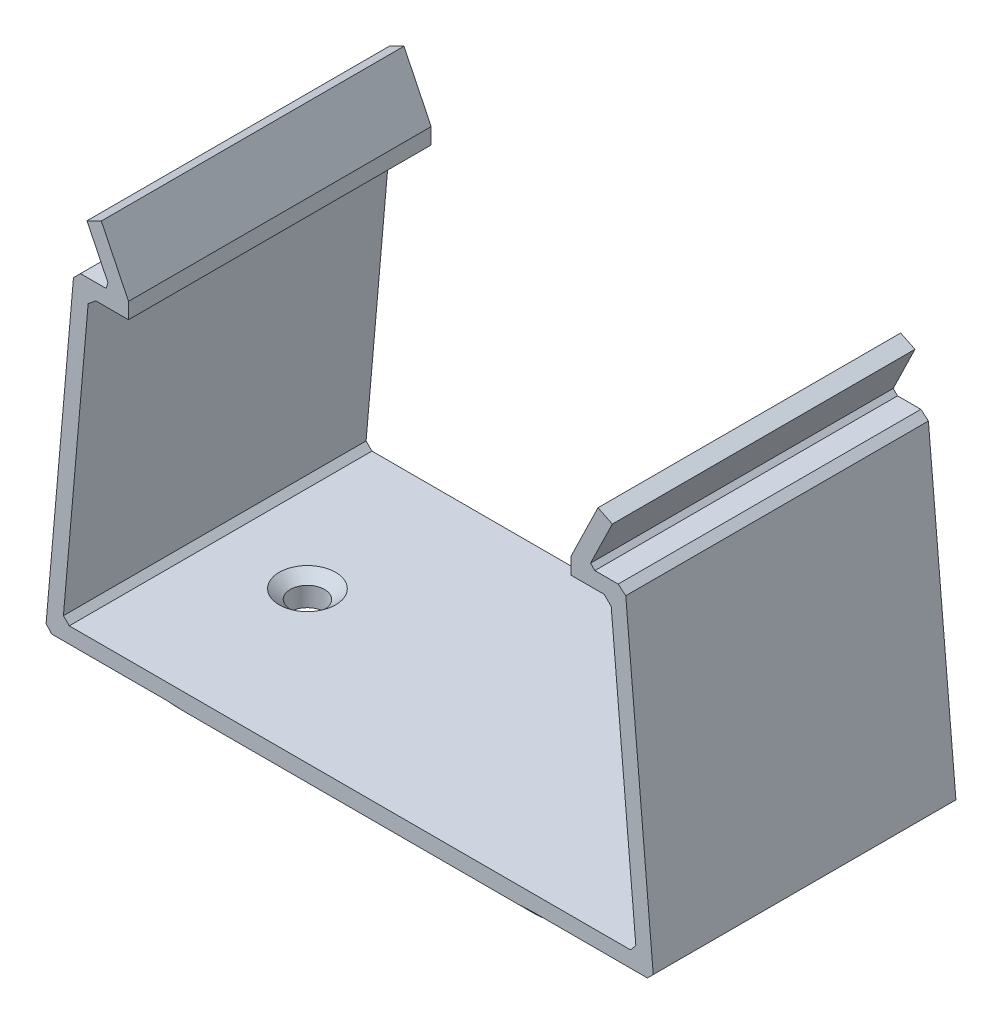
from build123d import *
from OCP.BRepFilletAPI import BRepFilletAPI_MakeChamfer

# Parameters (mm, degrees)
BOSS_EXTRUDE1_DEPTH                               = 38
SKETCH5_W                                         = 63
SKETCH5_H                                         = 38
BOSS_EXTRUDE2_DEPTH                               = 1.6
CHAMFER6_SIZE                                     = 0.8
CHAMFER6_SIZE2                                    = 0.738449877
CHAMFER7_SIZE                                     = 0.8
CHAMFER7_SIZE2                                    = 0.880050294
CHAMFER7_SIZE2_2                                  = 0.59857957
CSK_FOR_6_FLAT_HEAD_MACHINE_SCREW_100_D           = 4.3053
CSK_FOR_6_FLAT_HEAD_MACHINE_SCREW_100_DEPTH       = 3.6
CSK_FOR_6_FLAT_HEAD_MACHINE_SCREW_100_CSINK_D     = 7.0866
CSK_FOR_6_FLAT_HEAD_MACHINE_SCREW_100_CSINK_ANGLE = 100
FILLET1_R                                         = 10
CHAMFER10_SIZE                                    = 1.5


with BuildPart() as part:
    # Sketch1 → Boss-Extrude1 (new body)
    with BuildSketch(Plane.XY):
        Polygon((-34.595581798, 39), (-29.986555798, 39), (-32.97810591, 45.15618727), (-31.179250624, 46.030326652), (-27.76291945, 39), (-27.76291945, 37), (-32.76291945, 37), (-36, 0), (0, 0), (36, 0), (32.76291945, 37), (27.76291945, 37), (27.76291945, 39), (31.179250624, 46.030326652), (32.97810591, 45.15618727), (29.986555798, 39), (34.595581798, 39), (38.182617002, -2), (0, -2), (-38.182617002, -2), align=None)
    extrude(amount=BOSS_EXTRUDE1_DEPTH)

    # Sketch5 → Boss-Extrude2 (add)
    with BuildSketch(Plane.XZ.offset(2)):
        with Locations((0, 19)):
            Rectangle(SKETCH5_W, SKETCH5_H)
    extrude(amount=BOSS_EXTRUDE2_DEPTH)

    # Chamfer6: one chamfer whose edges measure the first distance from different faces: ONE call of the kernel's chamfer builder (chamfer() names one face for all edges)
    chamfer6_edges_1 = [part.edges().sort_by_distance(p)[0] for p in [
        (-36, 0, 19),
    ]]
    chamfer6_side_1 = [part.faces().sort_by_distance(p)[0] for p in [
        (0, 0, 19),
    ]]
    chamfer6_edges_2 = [part.edges().sort_by_distance(p)[0] for p in [
        (36, 0, 19),
    ]]
    chamfer6_side_2 = [part.faces().sort_by_distance(p)[0] for p in [
        (34.381459725, 18.5, 19),
    ]]
    chamfer6_edges_3 = [part.edges().sort_by_distance(p)[0] for p in [
        (38.182617002, -2, 19),
    ]]
    chamfer6_side_3 = [part.faces().sort_by_distance(p)[0] for p in [
        (34.841308501, -2, 19),
    ]]
    chamfer6_edges_4 = [part.edges().sort_by_distance(p)[0] for p in [
        (-38.182617002, -2, 19),
    ]]
    chamfer6_side_4 = [part.faces().sort_by_distance(p)[0] for p in [
        (-36.3890994, 18.5, 19),
    ]]
    chamfer6 = BRepFilletAPI_MakeChamfer(part.part.solid().wrapped)
    for e in chamfer6_edges_1:
        chamfer6.Add(CHAMFER6_SIZE, CHAMFER6_SIZE2, e.wrapped, chamfer6_side_1[0].wrapped)  # the first distance lies on this face
    for e in chamfer6_edges_2:
        chamfer6.Add(CHAMFER6_SIZE, CHAMFER6_SIZE2, e.wrapped, chamfer6_side_2[0].wrapped)  # the first distance lies on this face
    for e in chamfer6_edges_3:
        chamfer6.Add(CHAMFER6_SIZE, CHAMFER6_SIZE2, e.wrapped, chamfer6_side_3[0].wrapped)  # the first distance lies on this face
    for e in chamfer6_edges_4:
        chamfer6.Add(CHAMFER6_SIZE, CHAMFER6_SIZE2, e.wrapped, chamfer6_side_4[0].wrapped)  # the first distance lies on this face
    add(Compound.cast(chamfer6.Shape()), mode=Mode.REPLACE)

    # Chamfer7: one chamfer whose edges measure the first distance from different faces: ONE call of the kernel's chamfer builder (chamfer() names one face for all edges)
    chamfer7_edges_1 = [part.edges().sort_by_distance(p)[0] for p in [
        (-32.76291945, 37, 19),
    ]]
    chamfer7_side_1 = [part.faces().sort_by_distance(p)[0] for p in [
        (-34.349279651, 18.867819926, 19),
    ]]
    chamfer7_edges_2 = [part.edges().sort_by_distance(p)[0] for p in [
        (32.76291945, 37, 19),
    ]]
    chamfer7_side_2 = [part.faces().sort_by_distance(p)[0] for p in [
        (30.26291945, 37, 19),
    ]]
    chamfer7_edges_3 = [part.edges().sort_by_distance(p)[0] for p in [
        (29.986555798, 39, 19),
    ]]
    chamfer7_side_3 = [part.faces().sort_by_distance(p)[0] for p in [
        (32.291068798, 39, 19),
    ]]
    chamfer7_edges_4 = [part.edges().sort_by_distance(p)[0] for p in [
        (34.595581798, 39, 19),
    ]]
    chamfer7_side_4 = [part.faces().sort_by_distance(p)[0] for p in [
        (36.356919326, 18.867819926, 19),
    ]]
    chamfer7_edges_5 = [part.edges().sort_by_distance(p)[0] for p in [
        (-34.595581798, 39, 19),
    ]]
    chamfer7_side_5 = [part.faces().sort_by_distance(p)[0] for p in [
        (-32.291068798, 39, 19),
    ]]
    chamfer7_edges_6 = [part.edges().sort_by_distance(p)[0] for p in [
        (-29.986555798, 39, 19),
    ]]
    chamfer7_side_6 = [part.faces().sort_by_distance(p)[0] for p in [
        (-31.482330854, 42.078093635, 19),
    ]]
    chamfer7 = BRepFilletAPI_MakeChamfer(part.part.solid().wrapped)
    for e in chamfer7_edges_1:
        chamfer7.Add(CHAMFER7_SIZE, CHAMFER7_SIZE2, e.wrapped, chamfer7_side_1[0].wrapped)  # the first distance lies on this face
    for e in chamfer7_edges_2:
        chamfer7.Add(CHAMFER7_SIZE, CHAMFER7_SIZE2, e.wrapped, chamfer7_side_2[0].wrapped)  # the first distance lies on this face
    for e in chamfer7_edges_3:
        chamfer7.Add(CHAMFER7_SIZE, CHAMFER7_SIZE2_2, e.wrapped, chamfer7_side_3[0].wrapped)  # the first distance lies on this face
    for e in chamfer7_edges_4:
        chamfer7.Add(CHAMFER7_SIZE, CHAMFER7_SIZE2, e.wrapped, chamfer7_side_4[0].wrapped)  # the first distance lies on this face
    for e in chamfer7_edges_5:
        chamfer7.Add(CHAMFER7_SIZE, CHAMFER7_SIZE2, e.wrapped, chamfer7_side_5[0].wrapped)  # the first distance lies on this face
    for e in chamfer7_edges_6:
        chamfer7.Add(CHAMFER7_SIZE, CHAMFER7_SIZE2_2, e.wrapped, chamfer7_side_6[0].wrapped)  # the first distance lies on this face
    add(Compound.cast(chamfer7.Shape()), mode=Mode.REPLACE)

    # CSK for #6 Flat Head Machine Screw (100)1
    with Locations(Plane(origin=(0, 0, 0), x_dir=(1, 0, 0), z_dir=(0, 1, 0))):
        with Locations((24.3, -19), (-24.3, -19)):
            CounterSinkHole(CSK_FOR_6_FLAT_HEAD_MACHINE_SCREW_100_D / 2, CSK_FOR_6_FLAT_HEAD_MACHINE_SCREW_100_CSINK_D / 2, depth=CSK_FOR_6_FLAT_HEAD_MACHINE_SCREW_100_DEPTH, counter_sink_angle=CSK_FOR_6_FLAT_HEAD_MACHINE_SCREW_100_CSINK_ANGLE)

    # Fillet1
    fillet1_edges = [part.edges().sort_by_distance(p)[0] for p in [
        (-31.5, -2.8, 0),
        (31.5, -2.8, 0),
        (31.5, -2.8, 38),
        (-31.5, -2.8, 38),
    ]]
    fillet(fillet1_edges, radius=FILLET1_R)

    # Chamfer10
    chamfer10_edges = [part.edges().sort_by_distance(p)[0] for p in [
        (-31.5, -3.6, 19),
        (0, -3.6, 38),
        (0, -3.6, 0),
        (31.5, -3.6, 19),
        (28.571067812, -3.6, 35.071067812),
        (28.571067812, -3.6, 2.928932188),
        (-28.571067812, -3.6, 2.928932188),
        (-28.571067812, -3.6, 35.071067812),
    ]]
    chamfer(chamfer10_edges, length=CHAMFER10_SIZE)


solid = part.part
